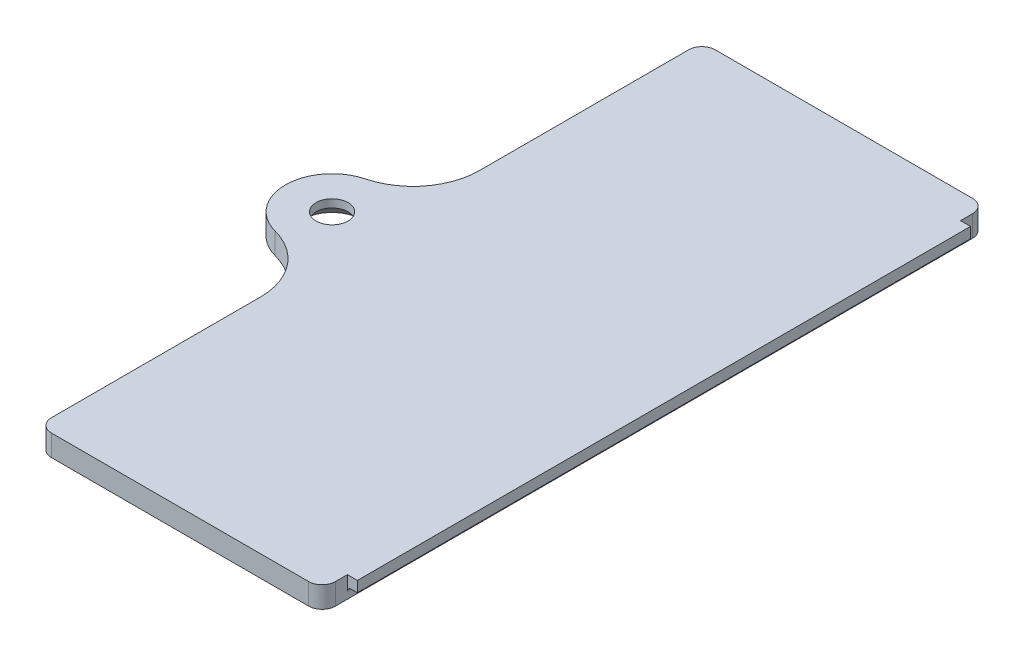
from build123d import *

# Parameters (mm, degrees)
DOOR_PLATE_1_6_SCREW_EAR_R5_R3_5_DEPTH        = 1.6
HOOK_FLANGE_0_75_X_0_8_INNER_FACE_P_2_W       = 0.9
HOOK_FLANGE_0_75_X_0_8_INNER_FACE_P_2_H       = 46
HOOK_FLANGE_0_75_X_0_8_INNER_FACE_PLANE_DEPTH = 0.8
SCREW_HOLE_2_4_FREE_SKETCH_R                  = 1.2
SCREW_HOLE_2_4_FREE_DEPTH                     = 73.114700304
SCREW_CSK_90DEG_M2_SIZE                       = 1
DOOR_CORNERS_R1_PRINT_R                       = 1
HOOK_FLANGE_ROOT_FILLET_R0_3_R                = 0.3
DOOR_TEXT_SLITS_8160749347_TIMER_REMOT_DEPTH  = 0.4
DOOR_TEXT_COUNTER_SLITS_OUTER_FACE_SKE_W      = 2.24
DOOR_TEXT_COUNTER_SLITS_OUTER_FACE_SKE_H      = 1.92
DOOR_TEXT_COUNTER_SLITS_OUTER_FACE_SKE_W_2    = 2.04
DOOR_TEXT_COUNTER_SLITS_OUTER_FACE_SKE_H_2    = 1.72
DOOR_TEXT_COUNTER_SLITS_OUTER_FACE_SKE_W_3    = 5.32
DOOR_TEXT_COUNTER_SLITS_OUTER_FACE_SKE_W_4    = 5.12
DOOR_TEXT_COUNTER_SLITS_OUTER_FACE_SKE_W_5    = 1.24
DOOR_TEXT_COUNTER_SLITS_OUTER_FACE_SKE_W_6    = 1.04
DOOR_TEXT_COUNTER_SLITS_OUTER_FACE_SKE_W_7    = 3.32
DOOR_TEXT_COUNTER_SLITS_OUTER_FACE_SKE_H_3    = 1.12
DOOR_TEXT_COUNTER_SLITS_OUTER_FACE_SKE_W_8    = 3.12
DOOR_TEXT_COUNTER_SLITS_OUTER_FACE_SKE_H_4    = 0.92
DOOR_TEXT_COUNTER_SLITS_OUTER_FACE_DEPTH      = 0.4


with BuildPart() as part:
    # Door Plate 1.6 + screw ear (R5 / R3.5) Sketch → Door Plate 1.6 + screw ear (R5 / R3.5) (new body)
    with BuildSketch(Plane(origin=(0, 0, 0), x_dir=(1, 0, 0), z_dir=(0, 1, 0))):
        with BuildLine():
            Line((9.35, 15.1), (30.65, 15.1))
            Line((30.65, 15.1), (30.65, 64.9))
            Line((30.65, 64.9), (9.35, 64.9))
            Line((9.35, 64.9), (9.35, 48.223594105))
            ThreePointArc((9.35, 48.223594105), (8.307494751, 45.167741475), (5.614705882, 43.386185808))
            ThreePointArc((5.614705882, 43.386185808), (3, 40), (5.614705882, 36.613814192))
            ThreePointArc((5.614705882, 36.613814192), (8.307494751, 34.832258525), (9.35, 31.776405895))
            Line((9.35, 31.776405895), (9.35, 15.1))
        make_face()
    extrude(amount=DOOR_PLATE_1_6_SCREW_EAR_R5_R3_5_DEPTH)

    # Hook Flange 0.75 x 0.8 _inner-face p 2 → Hook Flange 0.75 x 0.8 _inner-face plane (add)
    with BuildSketch(Plane(origin=(0, 0.8, 0), x_dir=(1, 0, 0), z_dir=(0, 1, 0))):
        with Locations((30.95, 40)):
            Rectangle(HOOK_FLANGE_0_75_X_0_8_INNER_FACE_P_2_W, HOOK_FLANGE_0_75_X_0_8_INNER_FACE_P_2_H)
    extrude(amount=HOOK_FLANGE_0_75_X_0_8_INNER_FACE_PLANE_DEPTH)

    # Screw Hole 2.4 (free) Sketch → Screw Hole 2.4 (free) (cut, through all)
    with BuildSketch(Plane(origin=(0, 0, 0), x_dir=(1, 0, 0), z_dir=(0, 1, 0))):
        with Locations(Location((6.5, 40, 0), (0, 0, 270))):
            Circle(SCREW_HOLE_2_4_FREE_SKETCH_R)
    extrude(amount=SCREW_HOLE_2_4_FREE_DEPTH, mode=Mode.SUBTRACT)

    # Screw CSK 90deg (M2)
    screw_csk_90deg_m2_edges = [part.edges().sort_by_distance(p)[0] for p in [
        (6.5, 0, -41.2),
    ]]
    chamfer(screw_csk_90deg_m2_edges, length=SCREW_CSK_90DEG_M2_SIZE)

    # Door Corners R1 (print)
    door_corners_r1_print_edges = [part.edges().sort_by_distance(p)[0] for p in [
        (9.35, 0.8, -64.9),
        (30.65, 0.8, -64.9),
        (30.65, 0.8, -15.1),
        (9.35, 0.8, -15.1),
    ]]
    fillet(door_corners_r1_print_edges, radius=DOOR_CORNERS_R1_PRINT_R)

    # Hook Flange Root Fillet R0.3
    hook_flange_root_fillet_r0_3_edges = [part.edges().sort_by_distance(p)[0] for p in [
        (30.65, 0.8, -40),
    ]]
    fillet(hook_flange_root_fillet_r0_3_edges, radius=HOOK_FLANGE_ROOT_FILLET_R0_3_R)

    # Door Text Slits 8160749347 _ TIMER R 2 → Door Text Slits 8160749347 _ TIMER REMOT (cut)
    # profile 1 of 21: a face of its own
    with BuildSketch(Plane(origin=(0, 0, 0), x_dir=(1, 0, 0), z_dir=(0, 1, 0))):
        with BuildLine():
            Line((27.28, 17.22), (21.12, 17.22))
            ThreePointArc((21.12, 17.22), (20.752304474, 17.372304474), (20.6, 17.74))
            Line((20.6, 17.74), (20.6, 20.5))
            ThreePointArc((20.6, 20.5), (20.752304474, 20.867695526), (21.12, 21.02))
            Line((21.12, 21.02), (27.28, 21.02))
            ThreePointArc((27.28, 21.02), (27.647695526, 20.867695526), (27.8, 20.5))
            Line((27.8, 20.5), (27.8, 17.74))
            ThreePointArc((27.8, 17.74), (27.647695526, 17.372304474), (27.28, 17.22))
        make_face()
        with BuildLine():
            Line((21.12, 17.32), (27.28, 17.32))
            ThreePointArc((27.28, 17.32), (27.576984848, 17.443015152), (27.7, 17.74))
            Line((27.7, 17.74), (27.7, 20.5))
            ThreePointArc((27.7, 20.5), (27.576984848, 20.796984848), (27.28, 20.92))
            Line((27.28, 20.92), (21.12, 20.92))
            ThreePointArc((21.12, 20.92), (20.823015152, 20.796984848), (20.7, 20.5))
            Line((20.7, 20.5), (20.7, 17.74))
            ThreePointArc((20.7, 17.74), (20.823015152, 17.443015152), (21.12, 17.32))
        make_face(mode=Mode.SUBTRACT)
    # profile 2 of 21: a face of its own
    with BuildSketch(Plane(origin=(0, 0, 0), x_dir=(1, 0, 0), z_dir=(0, 1, 0))):
        with BuildLine():
            Line((21.12, 24.28), (27.28, 24.28))
            ThreePointArc((27.28, 24.28), (27.647695526, 24.127695526), (27.8, 23.76))
            Line((27.8, 23.76), (27.8, 22.76))
            ThreePointArc((27.8, 22.76), (27.28, 22.24), (26.76, 22.76))
            Line((26.76, 22.76), (26.76, 23.24))
            Line((26.76, 23.24), (21.12, 23.24))
            ThreePointArc((21.12, 23.24), (20.6, 23.76), (21.12, 24.28))
        make_face()
        with BuildLine():
            Line((27.7, 23.76), (27.7, 22.76))
            ThreePointArc((27.7, 22.76), (27.28, 22.34), (26.86, 22.76))
            Line((26.86, 22.76), (26.86, 23.34))
            Line((26.86, 23.34), (21.12, 23.34))
            ThreePointArc((21.12, 23.34), (20.7, 23.76), (21.12, 24.18))
            Line((21.12, 24.18), (27.28, 24.18))
            ThreePointArc((27.28, 24.18), (27.576984848, 24.056984848), (27.7, 23.76))
        make_face(mode=Mode.SUBTRACT)
    # profile 3 of 21: a face of its own
    with BuildSketch(Plane(origin=(0, 0, 0), x_dir=(1, 0, 0), z_dir=(0, 1, 0))):
        with BuildLine():
            Line((21.12, 30.3), (24.2, 30.3))
            ThreePointArc((24.2, 30.3), (24.567695526, 30.147695526), (24.72, 29.78))
            Line((24.72, 29.78), (24.72, 27.54))
            Line((24.72, 27.54), (26.76, 27.54))
            Line((26.76, 27.54), (26.76, 29.78))
            ThreePointArc((26.76, 29.78), (27.28, 30.3), (27.8, 29.78))
            Line((27.8, 29.78), (27.8, 27.02))
            ThreePointArc((27.8, 27.02), (27.647695526, 26.652304474), (27.28, 26.5))
            Line((27.28, 26.5), (21.12, 26.5))
            ThreePointArc((21.12, 26.5), (20.752304474, 26.652304474), (20.6, 27.02))
            Line((20.6, 27.02), (20.6, 29.78))
            ThreePointArc((20.6, 29.78), (20.752304474, 30.147695526), (21.12, 30.3))
        make_face()
        with BuildLine():
            Line((27.7, 29.78), (27.7, 27.02))
            ThreePointArc((27.7, 27.02), (27.576984848, 26.723015152), (27.28, 26.6))
            Line((27.28, 26.6), (21.12, 26.6))
            ThreePointArc((21.12, 26.6), (20.823015152, 26.723015152), (20.7, 27.02))
            Line((20.7, 27.02), (20.7, 29.78))
            ThreePointArc((20.7, 29.78), (20.823015152, 30.076984848), (21.12, 30.2))
            Line((21.12, 30.2), (24.2, 30.2))
            ThreePointArc((24.2, 30.2), (24.496984848, 30.076984848), (24.62, 29.78))
            Line((24.62, 29.78), (24.62, 27.44))
            Line((24.62, 27.44), (26.86, 27.44))
            Line((26.86, 27.44), (26.86, 29.78))
            ThreePointArc((26.86, 29.78), (27.28, 30.2), (27.7, 29.78))
        make_face(mode=Mode.SUBTRACT)
    # profile 4 of 21: a face of its own
    with BuildSketch(Plane(origin=(0, 0, 0), x_dir=(1, 0, 0), z_dir=(0, 1, 0))):
        with BuildLine():
            Line((27.28, 31.14), (21.12, 31.14))
            ThreePointArc((21.12, 31.14), (20.752304474, 31.292304474), (20.6, 31.66))
            Line((20.6, 31.66), (20.6, 34.42))
            ThreePointArc((20.6, 34.42), (20.752304474, 34.787695526), (21.12, 34.94))
            Line((21.12, 34.94), (27.28, 34.94))
            ThreePointArc((27.28, 34.94), (27.647695526, 34.787695526), (27.8, 34.42))
            Line((27.8, 34.42), (27.8, 31.66))
            ThreePointArc((27.8, 31.66), (27.647695526, 31.292304474), (27.28, 31.14))
        make_face()
        with BuildLine():
            Line((21.12, 31.24), (27.28, 31.24))
            ThreePointArc((27.28, 31.24), (27.576984848, 31.363015152), (27.7, 31.66))
            Line((27.7, 31.66), (27.7, 34.42))
            ThreePointArc((27.7, 34.42), (27.576984848, 34.716984848), (27.28, 34.84))
            Line((27.28, 34.84), (21.12, 34.84))
            ThreePointArc((21.12, 34.84), (20.823015152, 34.716984848), (20.7, 34.42))
            Line((20.7, 34.42), (20.7, 31.66))
            ThreePointArc((20.7, 31.66), (20.823015152, 31.363015152), (21.12, 31.24))
        make_face(mode=Mode.SUBTRACT)
    # profile 5 of 21: a face of its own
    with BuildSketch(Plane(origin=(0, 0, 0), x_dir=(1, 0, 0), z_dir=(0, 1, 0))):
        with BuildLine():
            Line((20.983178949, 37.881677187), (27.143178949, 39.561677187))
            ThreePointArc((27.143178949, 39.561677187), (27.595636701, 39.473247472), (27.8, 39.06))
            Line((27.8, 39.06), (27.8, 36.3))
            ThreePointArc((27.8, 36.3), (27.28, 35.78), (26.76, 36.3))
            Line((26.76, 36.3), (26.76, 38.379189799))
            Line((26.76, 38.379189799), (21.256821051, 36.878322813))
            ThreePointArc((21.256821051, 36.878322813), (20.618322813, 37.243178949), (20.983178949, 37.881677187))
        make_face()
        with BuildLine():
            Line((27.7, 39.06), (27.7, 36.3))
            ThreePointArc((27.7, 36.3), (27.28, 35.88), (26.86, 36.3))
            Line((26.86, 36.3), (26.86, 38.510114838))
            Line((26.86, 38.510114838), (21.23050931, 36.974799195))
            ThreePointArc((21.23050931, 36.974799195), (20.714799195, 37.26949069), (21.00949069, 37.785200805))
            Line((21.00949069, 37.785200805), (27.16949069, 39.465200805))
            ThreePointArc((27.16949069, 39.465200805), (27.534937335, 39.393776804), (27.7, 39.06))
        make_face(mode=Mode.SUBTRACT)
    # profile 6 of 21: a face of its own
    with BuildSketch(Plane(origin=(0, 0, 0), x_dir=(1, 0, 0), z_dir=(0, 1, 0))):
        with BuildLine():
            Line((21.12, 44.22), (27.28, 44.22))
            ThreePointArc((27.28, 44.22), (27.647695526, 44.067695526), (27.8, 43.7))
            ThreePointArc((27.8, 43.7), (27.647695526, 43.332304474), (27.28, 43.18))
            Line((27.28, 43.18), (24.72, 43.18))
            Line((24.72, 43.18), (24.72, 41.46))
            Line((24.72, 41.46), (27.28, 41.46))
            ThreePointArc((27.28, 41.46), (27.647695526, 41.307695526), (27.8, 40.94))
            ThreePointArc((27.8, 40.94), (27.647695526, 40.572304474), (27.28, 40.42))
            Line((27.28, 40.42), (24.2, 40.42))
            ThreePointArc((24.2, 40.42), (23.832304474, 40.572304474), (23.68, 40.94))
            Line((23.68, 40.94), (23.68, 43.18))
            Line((23.68, 43.18), (21.12, 43.18))
            ThreePointArc((21.12, 43.18), (20.6, 43.7), (21.12, 44.22))
        make_face()
        with BuildLine():
            Line((27.28, 40.52), (24.2, 40.52))
            ThreePointArc((24.2, 40.52), (23.903015152, 40.643015152), (23.78, 40.94))
            Line((23.78, 40.94), (23.78, 43.28))
            Line((23.78, 43.28), (21.12, 43.28))
            ThreePointArc((21.12, 43.28), (20.7, 43.7), (21.12, 44.12))
            Line((21.12, 44.12), (27.28, 44.12))
            ThreePointArc((27.28, 44.12), (27.576984848, 43.996984848), (27.7, 43.7))
            ThreePointArc((27.7, 43.7), (27.576984848, 43.403015152), (27.28, 43.28))
            Line((27.28, 43.28), (24.62, 43.28))
            Line((24.62, 43.28), (24.62, 41.36))
            Line((24.62, 41.36), (27.28, 41.36))
            ThreePointArc((27.28, 41.36), (27.576984848, 41.236984848), (27.7, 40.94))
            ThreePointArc((27.7, 40.94), (27.576984848, 40.643015152), (27.28, 40.52))
        make_face(mode=Mode.SUBTRACT)
    # profile 7 of 21: a face of its own
    with BuildSketch(Plane(origin=(0, 0, 0), x_dir=(1, 0, 0), z_dir=(0, 1, 0))):
        with BuildLine():
            Line((23.68, 47.82), (21.64, 47.82))
            Line((21.64, 47.82), (21.64, 45.58))
            ThreePointArc((21.64, 45.58), (21.12, 45.06), (20.6, 45.58))
            Line((20.6, 45.58), (20.6, 48.34))
            ThreePointArc((20.6, 48.34), (20.752304474, 48.707695526), (21.12, 48.86))
            Line((21.12, 48.86), (27.28, 48.86))
            ThreePointArc((27.28, 48.86), (27.647695526, 48.707695526), (27.8, 48.34))
            Line((27.8, 48.34), (27.8, 45.58))
            ThreePointArc((27.8, 45.58), (27.647695526, 45.212304474), (27.28, 45.06))
            Line((27.28, 45.06), (24.2, 45.06))
            ThreePointArc((24.2, 45.06), (23.832304474, 45.212304474), (23.68, 45.58))
            Line((23.68, 45.58), (23.68, 47.82))
        make_face()
        with BuildLine():
            Line((20.7, 48.34), (20.7, 45.58))
            ThreePointArc((20.7, 45.58), (21.12, 45.16), (21.54, 45.58))
            Line((21.54, 45.58), (21.54, 47.92))
            Line((21.54, 47.92), (23.78, 47.92))
            Line((23.78, 47.92), (23.78, 45.58))
            ThreePointArc((23.78, 45.58), (23.903015152, 45.283015152), (24.2, 45.16))
            Line((24.2, 45.16), (27.28, 45.16))
            ThreePointArc((27.28, 45.16), (27.576984848, 45.283015152), (27.7, 45.58))
            Line((27.7, 45.58), (27.7, 48.34))
            ThreePointArc((27.7, 48.34), (27.576984848, 48.636984848), (27.28, 48.76))
            Line((27.28, 48.76), (21.12, 48.76))
            ThreePointArc((21.12, 48.76), (20.823015152, 48.636984848), (20.7, 48.34))
        make_face(mode=Mode.SUBTRACT)
    # profile 8 of 21: a face of its own
    with BuildSketch(Plane(origin=(0, 0, 0), x_dir=(1, 0, 0), z_dir=(0, 1, 0))):
        with BuildLine():
            Line((21.64, 52.46), (21.64, 50.22))
            ThreePointArc((21.64, 50.22), (21.12, 49.7), (20.6, 50.22))
            Line((20.6, 50.22), (20.6, 52.98))
            ThreePointArc((20.6, 52.98), (20.752304474, 53.347695526), (21.12, 53.5))
            Line((21.12, 53.5), (27.28, 53.5))
            ThreePointArc((27.28, 53.5), (27.647695526, 53.347695526), (27.8, 52.98))
            Line((27.8, 52.98), (27.8, 50.22))
            ThreePointArc((27.8, 50.22), (27.28, 49.7), (26.76, 50.22))
            Line((26.76, 50.22), (26.76, 52.46))
            Line((26.76, 52.46), (24.72, 52.46))
            Line((24.72, 52.46), (24.72, 51.02))
            ThreePointArc((24.72, 51.02), (24.2, 50.5), (23.68, 51.02))
            Line((23.68, 51.02), (23.68, 52.46))
            Line((23.68, 52.46), (21.64, 52.46))
        make_face()
        with BuildLine():
            Line((27.28, 53.4), (21.12, 53.4))
            ThreePointArc((21.12, 53.4), (20.823015152, 53.276984848), (20.7, 52.98))
            Line((20.7, 52.98), (20.7, 50.22))
            ThreePointArc((20.7, 50.22), (21.12, 49.8), (21.54, 50.22))
            Line((21.54, 50.22), (21.54, 52.56))
            Line((21.54, 52.56), (23.78, 52.56))
            Line((23.78, 52.56), (23.78, 51.02))
            ThreePointArc((23.78, 51.02), (24.2, 50.6), (24.62, 51.02))
            Line((24.62, 51.02), (24.62, 52.56))
            Line((24.62, 52.56), (26.86, 52.56))
            Line((26.86, 52.56), (26.86, 50.22))
            ThreePointArc((26.86, 50.22), (27.28, 49.8), (27.7, 50.22))
            Line((27.7, 50.22), (27.7, 52.98))
            ThreePointArc((27.7, 52.98), (27.576984848, 53.276984848), (27.28, 53.4))
        make_face(mode=Mode.SUBTRACT)
    # profile 9 of 21: a face of its own
    with BuildSketch(Plane(origin=(0, 0, 0), x_dir=(1, 0, 0), z_dir=(0, 1, 0))):
        with BuildLine():
            Line((21.12, 58.14), (27.28, 58.14))
            ThreePointArc((27.28, 58.14), (27.647695526, 57.987695526), (27.8, 57.62))
            ThreePointArc((27.8, 57.62), (27.647695526, 57.252304474), (27.28, 57.1))
            Line((27.28, 57.1), (24.72, 57.1))
            Line((24.72, 57.1), (24.72, 55.38))
            Line((24.72, 55.38), (27.28, 55.38))
            ThreePointArc((27.28, 55.38), (27.647695526, 55.227695526), (27.8, 54.86))
            ThreePointArc((27.8, 54.86), (27.647695526, 54.492304474), (27.28, 54.34))
            Line((27.28, 54.34), (24.2, 54.34))
            ThreePointArc((24.2, 54.34), (23.832304474, 54.492304474), (23.68, 54.86))
            Line((23.68, 54.86), (23.68, 57.1))
            Line((23.68, 57.1), (21.12, 57.1))
            ThreePointArc((21.12, 57.1), (20.6, 57.62), (21.12, 58.14))
        make_face()
        with BuildLine():
            Line((27.28, 54.44), (24.2, 54.44))
            ThreePointArc((24.2, 54.44), (23.903015152, 54.563015152), (23.78, 54.86))
            Line((23.78, 54.86), (23.78, 57.2))
            Line((23.78, 57.2), (21.12, 57.2))
            ThreePointArc((21.12, 57.2), (20.7, 57.62), (21.12, 58.04))
            Line((21.12, 58.04), (27.28, 58.04))
            ThreePointArc((27.28, 58.04), (27.576984848, 57.916984848), (27.7, 57.62))
            ThreePointArc((27.7, 57.62), (27.576984848, 57.323015152), (27.28, 57.2))
            Line((27.28, 57.2), (24.62, 57.2))
            Line((24.62, 57.2), (24.62, 55.28))
            Line((24.62, 55.28), (27.28, 55.28))
            ThreePointArc((27.28, 55.28), (27.576984848, 55.156984848), (27.7, 54.86))
            ThreePointArc((27.7, 54.86), (27.576984848, 54.563015152), (27.28, 54.44))
        make_face(mode=Mode.SUBTRACT)
    # profile 10 of 21: a face of its own
    with BuildSketch(Plane(origin=(0, 0, 0), x_dir=(1, 0, 0), z_dir=(0, 1, 0))):
        with BuildLine():
            Line((20.983178949, 61.081677187), (27.143178949, 62.761677187))
            ThreePointArc((27.143178949, 62.761677187), (27.595636701, 62.673247472), (27.8, 62.26))
            Line((27.8, 62.26), (27.8, 59.5))
            ThreePointArc((27.8, 59.5), (27.28, 58.98), (26.76, 59.5))
            Line((26.76, 59.5), (26.76, 61.579189799))
            Line((26.76, 61.579189799), (21.256821051, 60.078322813))
            ThreePointArc((21.256821051, 60.078322813), (20.618322813, 60.443178949), (20.983178949, 61.081677187))
        make_face()
        with BuildLine():
            Line((27.7, 62.26), (27.7, 59.5))
            ThreePointArc((27.7, 59.5), (27.28, 59.08), (26.86, 59.5))
            Line((26.86, 59.5), (26.86, 61.710114838))
            Line((26.86, 61.710114838), (21.23050931, 60.174799195))
            ThreePointArc((21.23050931, 60.174799195), (20.714799195, 60.46949069), (21.00949069, 60.985200805))
            Line((21.00949069, 60.985200805), (27.16949069, 62.665200805))
            ThreePointArc((27.16949069, 62.665200805), (27.534937335, 62.593776804), (27.7, 62.26))
        make_face(mode=Mode.SUBTRACT)
    # profile 11 of 21: a face of its own
    with BuildSketch(Plane(origin=(0, 0, 0), x_dir=(1, 0, 0), z_dir=(0, 1, 0))):
        with BuildLine():
            Line((14.12, 18.04), (17.76, 18.04))
            Line((17.76, 18.04), (17.76, 17.58))
            ThreePointArc((17.76, 17.58), (18.28, 17.06), (18.8, 17.58))
            Line((18.8, 17.58), (18.8, 19.54))
            ThreePointArc((18.8, 19.54), (18.28, 20.06), (17.76, 19.54))
            Line((17.76, 19.54), (17.76, 19.08))
            Line((17.76, 19.08), (14.12, 19.08))
            ThreePointArc((14.12, 19.08), (13.6, 18.56), (14.12, 18.04))
        make_face()
        with BuildLine():
            Line((18.7, 17.58), (18.7, 19.54))
            ThreePointArc((18.7, 19.54), (18.28, 19.96), (17.86, 19.54))
            Line((17.86, 19.54), (17.86, 18.98))
            Line((17.86, 18.98), (14.12, 18.98))
            ThreePointArc((14.12, 18.98), (13.7, 18.56), (14.12, 18.14))
            Line((14.12, 18.14), (17.86, 18.14))
            Line((17.86, 18.14), (17.86, 17.58))
            ThreePointArc((17.86, 17.58), (18.28, 17.16), (18.7, 17.58))
        make_face(mode=Mode.SUBTRACT)
    # profile 12 of 21: a face of its own
    with BuildSketch(Plane(origin=(0, 0, 0), x_dir=(1, 0, 0), z_dir=(0, 1, 0))):
        with BuildLine():
            Line((18.28, 20.9), (14.12, 20.9))
            ThreePointArc((14.12, 20.9), (13.6, 21.42), (14.12, 21.94))
            Line((14.12, 21.94), (18.28, 21.94))
            ThreePointArc((18.28, 21.94), (18.647695526, 21.787695526), (18.8, 21.42))
            ThreePointArc((18.8, 21.42), (18.647695526, 21.052304474), (18.28, 20.9))
        make_face()
        with BuildLine():
            Line((14.12, 21.84), (18.28, 21.84))
            ThreePointArc((18.28, 21.84), (18.576984848, 21.716984848), (18.7, 21.42))
            ThreePointArc((18.7, 21.42), (18.576984848, 21.123015152), (18.28, 21))
            Line((18.28, 21), (14.12, 21))
            ThreePointArc((14.12, 21), (13.7, 21.42), (14.12, 21.84))
        make_face(mode=Mode.SUBTRACT)
    # profile 13 of 21: a face of its own
    with BuildSketch(Plane(origin=(0, 0, 0), x_dir=(1, 0, 0), z_dir=(0, 1, 0))):
        with BuildLine():
            Line((17.76, 26.54), (14.12, 26.54))
            ThreePointArc((14.12, 26.54), (13.6, 27.06), (14.12, 27.58))
            Line((14.12, 27.58), (18.28, 27.58))
            ThreePointArc((18.28, 27.58), (18.647695526, 27.427695526), (18.8, 27.06))
            Line((18.8, 27.06), (18.8, 23.3))
            ThreePointArc((18.8, 23.3), (18.647695526, 22.932304474), (18.28, 22.78))
            Line((18.28, 22.78), (14.12, 22.78))
            ThreePointArc((14.12, 22.78), (13.6, 23.3), (14.12, 23.82))
            Line((14.12, 23.82), (17.76, 23.82))
            Line((17.76, 23.82), (17.76, 24.66))
            Line((17.76, 24.66), (15.9, 24.66))
            ThreePointArc((15.9, 24.66), (15.38, 25.18), (15.9, 25.7))
            Line((15.9, 25.7), (17.76, 25.7))
            Line((17.76, 25.7), (17.76, 26.54))
        make_face()
        with BuildLine():
            Line((18.7, 23.3), (18.7, 27.06))
            ThreePointArc((18.7, 27.06), (18.576984848, 27.356984848), (18.28, 27.48))
            Line((18.28, 27.48), (14.12, 27.48))
            ThreePointArc((14.12, 27.48), (13.7, 27.06), (14.12, 26.64))
            Line((14.12, 26.64), (17.86, 26.64))
            Line((17.86, 26.64), (17.86, 25.6))
            Line((17.86, 25.6), (15.9, 25.6))
            ThreePointArc((15.9, 25.6), (15.48, 25.18), (15.9, 24.76))
            Line((15.9, 24.76), (17.86, 24.76))
            Line((17.86, 24.76), (17.86, 23.72))
            Line((17.86, 23.72), (14.12, 23.72))
            ThreePointArc((14.12, 23.72), (13.7, 23.3), (14.12, 22.88))
            Line((14.12, 22.88), (18.28, 22.88))
            ThreePointArc((18.28, 22.88), (18.576984848, 23.003015152), (18.7, 23.3))
        make_face(mode=Mode.SUBTRACT)
    # profile 14 of 21: a face of its own
    with BuildSketch(Plane(origin=(0, 0, 0), x_dir=(1, 0, 0), z_dir=(0, 1, 0))):
        with BuildLine():
            Line((14.64, 30.5), (14.64, 29.46))
            Line((14.64, 29.46), (15.68, 29.46))
            Line((15.68, 29.46), (15.68, 30.2))
            ThreePointArc((15.68, 30.2), (16.2, 30.72), (16.72, 30.2))
            Line((16.72, 30.2), (16.72, 29.46))
            Line((16.72, 29.46), (17.76, 29.46))
            Line((17.76, 29.46), (17.76, 30.5))
            ThreePointArc((17.76, 30.5), (18.28, 31.02), (18.8, 30.5))
            Line((18.8, 30.5), (18.8, 28.94))
            ThreePointArc((18.8, 28.94), (18.647695526, 28.572304474), (18.28, 28.42))
            Line((18.28, 28.42), (14.12, 28.42))
            ThreePointArc((14.12, 28.42), (13.752304474, 28.572304474), (13.6, 28.94))
            Line((13.6, 28.94), (13.6, 30.5))
            ThreePointArc((13.6, 30.5), (14.12, 31.02), (14.64, 30.5))
        make_face()
        with BuildLine():
            Line((18.7, 30.5), (18.7, 28.94))
            ThreePointArc((18.7, 28.94), (18.576984848, 28.643015152), (18.28, 28.52))
            Line((18.28, 28.52), (14.12, 28.52))
            ThreePointArc((14.12, 28.52), (13.823015152, 28.643015152), (13.7, 28.94))
            Line((13.7, 28.94), (13.7, 30.5))
            ThreePointArc((13.7, 30.5), (14.12, 30.92), (14.54, 30.5))
            Line((14.54, 30.5), (14.54, 29.36))
            Line((14.54, 29.36), (15.78, 29.36))
            Line((15.78, 29.36), (15.78, 30.2))
            ThreePointArc((15.78, 30.2), (16.2, 30.62), (16.62, 30.2))
            Line((16.62, 30.2), (16.62, 29.36))
            Line((16.62, 29.36), (17.86, 29.36))
            Line((17.86, 29.36), (17.86, 30.5))
            ThreePointArc((17.86, 30.5), (18.28, 30.92), (18.7, 30.5))
        make_face(mode=Mode.SUBTRACT)
    # profile 15 of 21: a face of its own
    with BuildSketch(Plane(origin=(0, 0, 0), x_dir=(1, 0, 0), z_dir=(0, 1, 0))):
        with BuildLine():
            Line((15.68, 35.14), (15.68, 35.044623769))
            Line((15.68, 35.044623769), (14.322612795, 35.618902971))
            ThreePointArc((14.322612795, 35.618902971), (13.641097029, 35.342612795), (13.917387205, 34.661097029))
            Line((13.917387205, 34.661097029), (15.68, 33.915376231))
            Line((15.68, 33.915376231), (15.68, 32.9))
            Line((15.68, 32.9), (14.12, 32.9))
            ThreePointArc((14.12, 32.9), (13.6, 32.38), (14.12, 31.86))
            Line((14.12, 31.86), (18.28, 31.86))
            ThreePointArc((18.28, 31.86), (18.647695526, 32.012304474), (18.8, 32.38))
            Line((18.8, 32.38), (18.8, 35.14))
            ThreePointArc((18.8, 35.14), (18.647695526, 35.507695526), (18.28, 35.66))
            Line((18.28, 35.66), (16.2, 35.66))
            ThreePointArc((16.2, 35.66), (15.832304474, 35.507695526), (15.68, 35.14))
        make_face()
        with BuildLine():
            Line((14.12, 31.96), (18.28, 31.96))
            ThreePointArc((18.28, 31.96), (18.576984848, 32.083015152), (18.7, 32.38))
            Line((18.7, 32.38), (18.7, 35.14))
            ThreePointArc((18.7, 35.14), (18.576984848, 35.436984848), (18.28, 35.56))
            Line((18.28, 35.56), (16.2, 35.56))
            ThreePointArc((16.2, 35.56), (15.903015152, 35.436984848), (15.78, 35.14))
            Line((15.78, 35.14), (15.78, 34.893734582))
            Line((15.78, 34.893734582), (14.283648796, 35.526806245))
            ThreePointArc((14.283648796, 35.526806245), (13.733193755, 35.303648796), (13.956351204, 34.753193755))
            Line((13.956351204, 34.753193755), (15.78, 33.981650033))
            Line((15.78, 33.981650033), (15.78, 32.8))
            Line((15.78, 32.8), (14.12, 32.8))
            ThreePointArc((14.12, 32.8), (13.7, 32.38), (14.12, 31.96))
        make_face(mode=Mode.SUBTRACT)
    # profile 16 of 21: a face of its own
    with BuildSketch(Plane(origin=(0, 0, 0), x_dir=(1, 0, 0), z_dir=(0, 1, 0))):
        with BuildLine():
            Line((15.68, 42.22), (15.68, 42.124623769))
            Line((15.68, 42.124623769), (14.322612795, 42.698902971))
            ThreePointArc((14.322612795, 42.698902971), (13.641097029, 42.422612795), (13.917387205, 41.741097029))
            Line((13.917387205, 41.741097029), (15.68, 40.995376231))
            Line((15.68, 40.995376231), (15.68, 39.98))
            Line((15.68, 39.98), (14.12, 39.98))
            ThreePointArc((14.12, 39.98), (13.6, 39.46), (14.12, 38.94))
            Line((14.12, 38.94), (18.28, 38.94))
            ThreePointArc((18.28, 38.94), (18.647695526, 39.092304474), (18.8, 39.46))
            Line((18.8, 39.46), (18.8, 42.22))
            ThreePointArc((18.8, 42.22), (18.647695526, 42.587695526), (18.28, 42.74))
            Line((18.28, 42.74), (16.2, 42.74))
            ThreePointArc((16.2, 42.74), (15.832304474, 42.587695526), (15.68, 42.22))
        make_face()
        with BuildLine():
            Line((14.12, 39.04), (18.28, 39.04))
            ThreePointArc((18.28, 39.04), (18.576984848, 39.163015152), (18.7, 39.46))
            Line((18.7, 39.46), (18.7, 42.22))
            ThreePointArc((18.7, 42.22), (18.576984848, 42.516984848), (18.28, 42.64))
            Line((18.28, 42.64), (16.2, 42.64))
            ThreePointArc((16.2, 42.64), (15.903015152, 42.516984848), (15.78, 42.22))
            Line((15.78, 42.22), (15.78, 41.973734582))
            Line((15.78, 41.973734582), (14.283648796, 42.606806245))
            ThreePointArc((14.283648796, 42.606806245), (13.733193755, 42.383648796), (13.956351204, 41.833193755))
            Line((13.956351204, 41.833193755), (15.78, 41.061650033))
            Line((15.78, 41.061650033), (15.78, 39.88))
            Line((15.78, 39.88), (14.12, 39.88))
            ThreePointArc((14.12, 39.88), (13.7, 39.46), (14.12, 39.04))
        make_face(mode=Mode.SUBTRACT)
    # profile 17 of 21: a face of its own
    with BuildSketch(Plane(origin=(0, 0, 0), x_dir=(1, 0, 0), z_dir=(0, 1, 0))):
        with BuildLine():
            Line((14.64, 45.66), (14.64, 44.62))
            Line((14.64, 44.62), (15.68, 44.62))
            Line((15.68, 44.62), (15.68, 45.36))
            ThreePointArc((15.68, 45.36), (16.2, 45.88), (16.72, 45.36))
            Line((16.72, 45.36), (16.72, 44.62))
            Line((16.72, 44.62), (17.76, 44.62))
            Line((17.76, 44.62), (17.76, 45.66))
            ThreePointArc((17.76, 45.66), (18.28, 46.18), (18.8, 45.66))
            Line((18.8, 45.66), (18.8, 44.1))
            ThreePointArc((18.8, 44.1), (18.647695526, 43.732304474), (18.28, 43.58))
            Line((18.28, 43.58), (14.12, 43.58))
            ThreePointArc((14.12, 43.58), (13.752304474, 43.732304474), (13.6, 44.1))
            Line((13.6, 44.1), (13.6, 45.66))
            ThreePointArc((13.6, 45.66), (14.12, 46.18), (14.64, 45.66))
        make_face()
        with BuildLine():
            Line((18.7, 45.66), (18.7, 44.1))
            ThreePointArc((18.7, 44.1), (18.576984848, 43.803015152), (18.28, 43.68))
            Line((18.28, 43.68), (14.12, 43.68))
            ThreePointArc((14.12, 43.68), (13.823015152, 43.803015152), (13.7, 44.1))
            Line((13.7, 44.1), (13.7, 45.66))
            ThreePointArc((13.7, 45.66), (14.12, 46.08), (14.54, 45.66))
            Line((14.54, 45.66), (14.54, 44.52))
            Line((14.54, 44.52), (15.78, 44.52))
            Line((15.78, 44.52), (15.78, 45.36))
            ThreePointArc((15.78, 45.36), (16.2, 45.78), (16.62, 45.36))
            Line((16.62, 45.36), (16.62, 44.52))
            Line((16.62, 44.52), (17.86, 44.52))
            Line((17.86, 44.52), (17.86, 45.66))
            ThreePointArc((17.86, 45.66), (18.28, 46.08), (18.7, 45.66))
        make_face(mode=Mode.SUBTRACT)
    # profile 18 of 21: a face of its own
    with BuildSketch(Plane(origin=(0, 0, 0), x_dir=(1, 0, 0), z_dir=(0, 1, 0))):
        with BuildLine():
            Line((17.76, 50.78), (14.12, 50.78))
            ThreePointArc((14.12, 50.78), (13.6, 51.3), (14.12, 51.82))
            Line((14.12, 51.82), (18.28, 51.82))
            ThreePointArc((18.28, 51.82), (18.647695526, 51.667695526), (18.8, 51.3))
            Line((18.8, 51.3), (18.8, 47.54))
            ThreePointArc((18.8, 47.54), (18.647695526, 47.172304474), (18.28, 47.02))
            Line((18.28, 47.02), (14.12, 47.02))
            ThreePointArc((14.12, 47.02), (13.6, 47.54), (14.12, 48.06))
            Line((14.12, 48.06), (17.76, 48.06))
            Line((17.76, 48.06), (17.76, 48.9))
            Line((17.76, 48.9), (15.9, 48.9))
            ThreePointArc((15.9, 48.9), (15.38, 49.42), (15.9, 49.94))
            Line((15.9, 49.94), (17.76, 49.94))
            Line((17.76, 49.94), (17.76, 50.78))
        make_face()
        with BuildLine():
            Line((18.7, 47.54), (18.7, 51.3))
            ThreePointArc((18.7, 51.3), (18.576984848, 51.596984848), (18.28, 51.72))
            Line((18.28, 51.72), (14.12, 51.72))
            ThreePointArc((14.12, 51.72), (13.7, 51.3), (14.12, 50.88))
            Line((14.12, 50.88), (17.86, 50.88))
            Line((17.86, 50.88), (17.86, 49.84))
            Line((17.86, 49.84), (15.9, 49.84))
            ThreePointArc((15.9, 49.84), (15.48, 49.42), (15.9, 49))
            Line((15.9, 49), (17.86, 49))
            Line((17.86, 49), (17.86, 47.96))
            Line((17.86, 47.96), (14.12, 47.96))
            ThreePointArc((14.12, 47.96), (13.7, 47.54), (14.12, 47.12))
            Line((14.12, 47.12), (18.28, 47.12))
            ThreePointArc((18.28, 47.12), (18.576984848, 47.243015152), (18.7, 47.54))
        make_face(mode=Mode.SUBTRACT)
    # profile 19 of 21: a face of its own
    with BuildSketch(Plane(origin=(0, 0, 0), x_dir=(1, 0, 0), z_dir=(0, 1, 0))):
        with BuildLine():
            Line((18.28, 52.66), (14.12, 52.66))
            ThreePointArc((14.12, 52.66), (13.752304474, 52.812304474), (13.6, 53.18))
            Line((13.6, 53.18), (13.6, 55.14))
            ThreePointArc((13.6, 55.14), (13.752304474, 55.507695526), (14.12, 55.66))
            Line((14.12, 55.66), (18.28, 55.66))
            ThreePointArc((18.28, 55.66), (18.647695526, 55.507695526), (18.8, 55.14))
            Line((18.8, 55.14), (18.8, 53.18))
            ThreePointArc((18.8, 53.18), (18.647695526, 52.812304474), (18.28, 52.66))
        make_face()
        with BuildLine():
            Line((14.12, 52.76), (18.28, 52.76))
            ThreePointArc((18.28, 52.76), (18.576984848, 52.883015152), (18.7, 53.18))
            Line((18.7, 53.18), (18.7, 55.14))
            ThreePointArc((18.7, 55.14), (18.576984848, 55.436984848), (18.28, 55.56))
            Line((18.28, 55.56), (14.12, 55.56))
            ThreePointArc((14.12, 55.56), (13.823015152, 55.436984848), (13.7, 55.14))
            Line((13.7, 55.14), (13.7, 53.18))
            ThreePointArc((13.7, 53.18), (13.823015152, 52.883015152), (14.12, 52.76))
        make_face(mode=Mode.SUBTRACT)
    # profile 20 of 21: a face of its own
    with BuildSketch(Plane(origin=(0, 0, 0), x_dir=(1, 0, 0), z_dir=(0, 1, 0))):
        with BuildLine():
            Line((14.12, 57.48), (17.76, 57.48))
            Line((17.76, 57.48), (17.76, 57.02))
            ThreePointArc((17.76, 57.02), (18.28, 56.5), (18.8, 57.02))
            Line((18.8, 57.02), (18.8, 58.98))
            ThreePointArc((18.8, 58.98), (18.28, 59.5), (17.76, 58.98))
            Line((17.76, 58.98), (17.76, 58.52))
            Line((17.76, 58.52), (14.12, 58.52))
            ThreePointArc((14.12, 58.52), (13.6, 58), (14.12, 57.48))
        make_face()
        with BuildLine():
            Line((18.7, 57.02), (18.7, 58.98))
            ThreePointArc((18.7, 58.98), (18.28, 59.4), (17.86, 58.98))
            Line((17.86, 58.98), (17.86, 58.42))
            Line((17.86, 58.42), (14.12, 58.42))
            ThreePointArc((14.12, 58.42), (13.7, 58), (14.12, 57.58))
            Line((14.12, 57.58), (17.86, 57.58))
            Line((17.86, 57.58), (17.86, 57.02))
            ThreePointArc((17.86, 57.02), (18.28, 56.6), (18.7, 57.02))
        make_face(mode=Mode.SUBTRACT)
    # profile 21 of 21: a face of its own
    with BuildSketch(Plane(origin=(0, 0, 0), x_dir=(1, 0, 0), z_dir=(0, 1, 0))):
        with BuildLine():
            Line((14.64, 62.42), (14.64, 61.38))
            Line((14.64, 61.38), (15.68, 61.38))
            Line((15.68, 61.38), (15.68, 62.12))
            ThreePointArc((15.68, 62.12), (16.2, 62.64), (16.72, 62.12))
            Line((16.72, 62.12), (16.72, 61.38))
            Line((16.72, 61.38), (17.76, 61.38))
            Line((17.76, 61.38), (17.76, 62.42))
            ThreePointArc((17.76, 62.42), (18.28, 62.94), (18.8, 62.42))
            Line((18.8, 62.42), (18.8, 60.86))
            ThreePointArc((18.8, 60.86), (18.647695526, 60.492304474), (18.28, 60.34))
            Line((18.28, 60.34), (14.12, 60.34))
            ThreePointArc((14.12, 60.34), (13.752304474, 60.492304474), (13.6, 60.86))
            Line((13.6, 60.86), (13.6, 62.42))
            ThreePointArc((13.6, 62.42), (14.12, 62.94), (14.64, 62.42))
        make_face()
        with BuildLine():
            Line((18.7, 62.42), (18.7, 60.86))
            ThreePointArc((18.7, 60.86), (18.576984848, 60.563015152), (18.28, 60.44))
            Line((18.28, 60.44), (14.12, 60.44))
            ThreePointArc((14.12, 60.44), (13.823015152, 60.563015152), (13.7, 60.86))
            Line((13.7, 60.86), (13.7, 62.42))
            ThreePointArc((13.7, 62.42), (14.12, 62.84), (14.54, 62.42))
            Line((14.54, 62.42), (14.54, 61.28))
            Line((14.54, 61.28), (15.78, 61.28))
            Line((15.78, 61.28), (15.78, 62.12))
            ThreePointArc((15.78, 62.12), (16.2, 62.54), (16.62, 62.12))
            Line((16.62, 62.12), (16.62, 61.28))
            Line((16.62, 61.28), (17.86, 61.28))
            Line((17.86, 61.28), (17.86, 62.42))
            ThreePointArc((17.86, 62.42), (18.28, 62.84), (18.7, 62.42))
        make_face(mode=Mode.SUBTRACT)
    extrude(amount=DOOR_TEXT_SLITS_8160749347_TIMER_REMOT_DEPTH, mode=Mode.SUBTRACT)

    # Door Text Counter Slits (outer face) Sketch → Door Text Counter Slits (outer face) (cut)
    # profile 1 of 8: a face of its own
    with BuildSketch(Plane(origin=(0, 0, 0), x_dir=(1, 0, 0), z_dir=(0, 1, 0))):
        with Locations((25.74, 19.12)):
            Rectangle(DOOR_TEXT_COUNTER_SLITS_OUTER_FACE_SKE_W, DOOR_TEXT_COUNTER_SLITS_OUTER_FACE_SKE_H)
        with Locations((25.74, 19.12)):
            Rectangle(DOOR_TEXT_COUNTER_SLITS_OUTER_FACE_SKE_W_2, DOOR_TEXT_COUNTER_SLITS_OUTER_FACE_SKE_H_2, mode=Mode.SUBTRACT)
    # profile 2 of 8: a face of its own
    with BuildSketch(Plane(origin=(0, 0, 0), x_dir=(1, 0, 0), z_dir=(0, 1, 0))):
        with Locations((22.66, 19.12)):
            Rectangle(DOOR_TEXT_COUNTER_SLITS_OUTER_FACE_SKE_W, DOOR_TEXT_COUNTER_SLITS_OUTER_FACE_SKE_H)
        with Locations((22.66, 19.12)):
            Rectangle(DOOR_TEXT_COUNTER_SLITS_OUTER_FACE_SKE_W_2, DOOR_TEXT_COUNTER_SLITS_OUTER_FACE_SKE_H_2, mode=Mode.SUBTRACT)
    # profile 3 of 8: a face of its own
    with BuildSketch(Plane(origin=(0, 0, 0), x_dir=(1, 0, 0), z_dir=(0, 1, 0))):
        with Locations((22.66, 28.4)):
            Rectangle(DOOR_TEXT_COUNTER_SLITS_OUTER_FACE_SKE_W, DOOR_TEXT_COUNTER_SLITS_OUTER_FACE_SKE_H)
        with Locations((22.66, 28.4)):
            Rectangle(DOOR_TEXT_COUNTER_SLITS_OUTER_FACE_SKE_W_2, DOOR_TEXT_COUNTER_SLITS_OUTER_FACE_SKE_H_2, mode=Mode.SUBTRACT)
    # profile 4 of 8: a face of its own
    with BuildSketch(Plane(origin=(0, 0, 0), x_dir=(1, 0, 0), z_dir=(0, 1, 0))):
        with Locations((24.2, 33.04)):
            Rectangle(DOOR_TEXT_COUNTER_SLITS_OUTER_FACE_SKE_W_3, DOOR_TEXT_COUNTER_SLITS_OUTER_FACE_SKE_H)
        with Locations((24.2, 33.04)):
            Rectangle(DOOR_TEXT_COUNTER_SLITS_OUTER_FACE_SKE_W_4, DOOR_TEXT_COUNTER_SLITS_OUTER_FACE_SKE_H_2, mode=Mode.SUBTRACT)
    # profile 5 of 8: a face of its own
    with BuildSketch(Plane(origin=(0, 0, 0), x_dir=(1, 0, 0), z_dir=(0, 1, 0))):
        with Locations((25.74, 46.96)):
            Rectangle(DOOR_TEXT_COUNTER_SLITS_OUTER_FACE_SKE_W, DOOR_TEXT_COUNTER_SLITS_OUTER_FACE_SKE_H)
        with Locations((25.74, 46.96)):
            Rectangle(DOOR_TEXT_COUNTER_SLITS_OUTER_FACE_SKE_W_2, DOOR_TEXT_COUNTER_SLITS_OUTER_FACE_SKE_H_2, mode=Mode.SUBTRACT)
    # profile 6 of 8: a face of its own
    with BuildSketch(Plane(origin=(0, 0, 0), x_dir=(1, 0, 0), z_dir=(0, 1, 0))):
        with Locations((17.24, 33.76)):
            Rectangle(DOOR_TEXT_COUNTER_SLITS_OUTER_FACE_SKE_W_5, DOOR_TEXT_COUNTER_SLITS_OUTER_FACE_SKE_H)
        with Locations((17.24, 33.76)):
            Rectangle(DOOR_TEXT_COUNTER_SLITS_OUTER_FACE_SKE_W_6, DOOR_TEXT_COUNTER_SLITS_OUTER_FACE_SKE_H_2, mode=Mode.SUBTRACT)
    # profile 7 of 8: a face of its own
    with BuildSketch(Plane(origin=(0, 0, 0), x_dir=(1, 0, 0), z_dir=(0, 1, 0))):
        with Locations((17.24, 40.84)):
            Rectangle(DOOR_TEXT_COUNTER_SLITS_OUTER_FACE_SKE_W_5, DOOR_TEXT_COUNTER_SLITS_OUTER_FACE_SKE_H)
        with Locations((17.24, 40.84)):
            Rectangle(DOOR_TEXT_COUNTER_SLITS_OUTER_FACE_SKE_W_6, DOOR_TEXT_COUNTER_SLITS_OUTER_FACE_SKE_H_2, mode=Mode.SUBTRACT)
    # profile 8 of 8: a face of its own
    with BuildSketch(Plane(origin=(0, 0, 0), x_dir=(1, 0, 0), z_dir=(0, 1, 0))):
        with Locations((16.2, 54.16)):
            Rectangle(DOOR_TEXT_COUNTER_SLITS_OUTER_FACE_SKE_W_7, DOOR_TEXT_COUNTER_SLITS_OUTER_FACE_SKE_H_3)
        with Locations((16.2, 54.16)):
            Rectangle(DOOR_TEXT_COUNTER_SLITS_OUTER_FACE_SKE_W_8, DOOR_TEXT_COUNTER_SLITS_OUTER_FACE_SKE_H_4, mode=Mode.SUBTRACT)
    extrude(amount=DOOR_TEXT_COUNTER_SLITS_OUTER_FACE_DEPTH, mode=Mode.SUBTRACT)


solid = part.part
